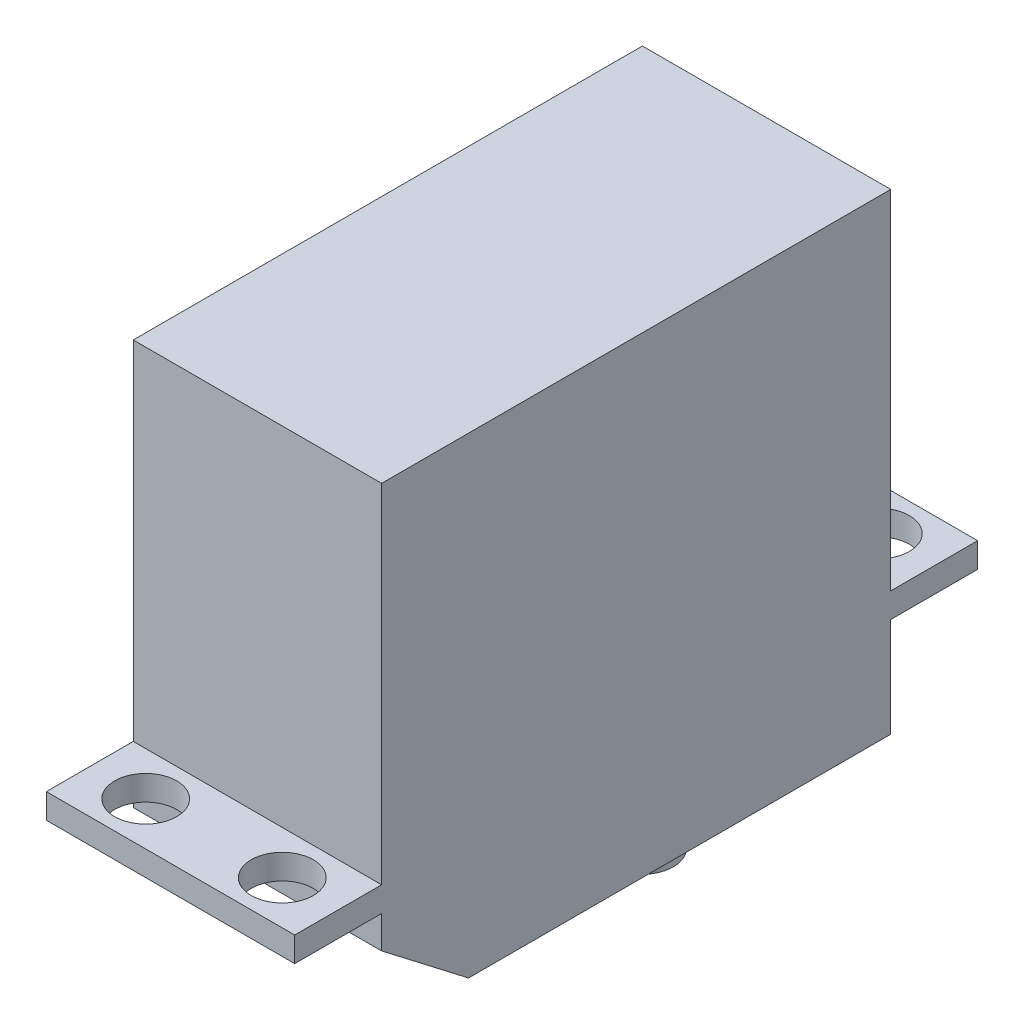
from build123d import *

# Parameters (mm, degrees)
SALIENTE_EXTRUIR1_DEPTH = 20
CROQUIS2_R              = 2.5
SALIENTE_EXTRUIR2_DEPTH = 8
CROQUIS3_R              = 2.5
CORTAR_EXTRUIR1_DEPTH   = 10


with BuildPart() as part:
    # Croquis1 → Saliente-Extruir1 (new body)
    with BuildSketch(Plane(origin=(0, 0, 0), x_dir=(0, 0, -1), z_dir=(1, 0, 0))):
        Polygon((41, 10), (48, 10), (48, 8), (41, 8), (41, 0), (7, 0), (0, 5.387789056), (0, 8), (-7, 8), (-7, 10), (0, 10), (0, 38), (41, 38), align=None)
    extrude(amount=SALIENTE_EXTRUIR1_DEPTH)

    # Croquis2 → Saliente-Extruir2 (add)
    with BuildSketch(Plane.XZ):
        with Locations(Location((10, -31, 0), (0, 0, 90))):
            Circle(CROQUIS2_R)
    extrude(amount=SALIENTE_EXTRUIR2_DEPTH)

    # Croquis3 → Cortar-Extruir1 (cut)
    with BuildSketch(Plane.XZ.offset(-8)):
        with Locations(Location((4.5, 3.5, 0), (0, 0, 270))):
            Circle(CROQUIS3_R)
        with Locations(Location((15.5, 3.5, 0), (0, 0, 270))):
            Circle(CROQUIS3_R)
        with Locations(Location((15.5, -44.5, 0), (0, 0, 270))):
            Circle(CROQUIS3_R)
        with Locations(Location((4.5, -44.5, 0), (0, 0, 270))):
            Circle(CROQUIS3_R)
    extrude(amount=-CORTAR_EXTRUIR1_DEPTH, mode=Mode.SUBTRACT)


solid = part.part
